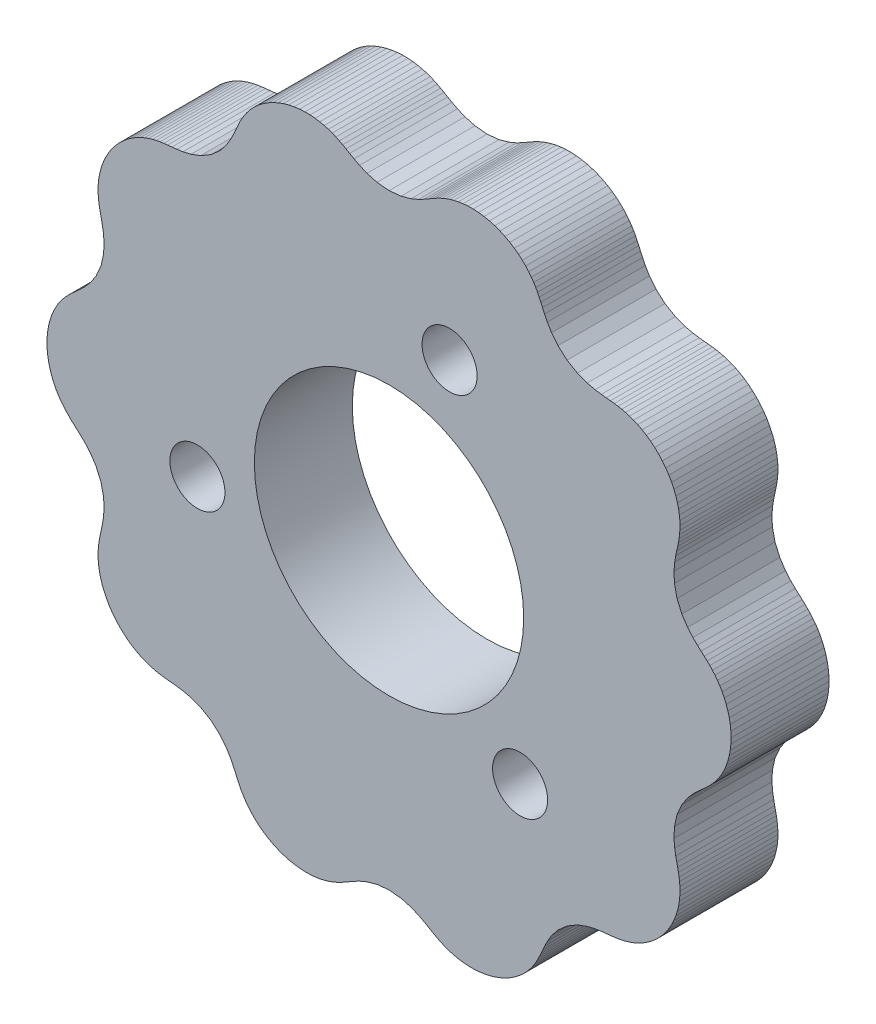
from build123d import *

# Parameters (mm, degrees)
MODEL_R             = 8.73125
BOSS_EXTRUDE1_DEPTH = 6.35
SKETCH2_R           = 1.78435
CUT_EXTRUDE1_DEPTH  = 33.323771723
SKETCH3_R           = 3.175
CUT_EXTRUDE2_DEPTH  = 3.81


with BuildPart() as part:
    # Model → Boss-Extrude1 (new body)
    with BuildSketch(Plane.XY):
        Polygon((20.90416592, 0), (20.890931284, 0.361246536), (20.851630676, 0.717938171), (20.787453815, 1.065699726), (20.70031633, 1.40051076), (20.592758773, 1.718871579), (20.467804656, 2.017956811), (20.328775926, 2.29575465), (20.179062376, 2.551192441), (20.021838, 2.784253604), (19.859711664, 2.996098554), (19.694291065, 3.189216289), (19.525628153, 3.36766), (19.351506826, 3.537471764), (19.166554614, 3.707500416), (18.961299064, 3.890989773), (18.721830857, 4.10851653), (18.432408361, 4.392542238), (18.086923383, 4.790426506), (17.715401805, 5.350520314), (17.403006197, 6.067227501), (17.234469638, 6.830677327), (17.205822028, 7.50217764), (17.251454741, 8.02714375), (17.318656337, 8.42704365), (17.384531166, 8.743782373), (17.442734057, 9.012874567), (17.492423206, 9.259142818), (17.533477467, 9.498869369), (17.565042048, 9.742370936), (17.585358367, 9.995838254), (17.59200199, 10.262519888), (17.582209268, 10.543484499), (17.553187508, 10.83813743), (17.502378641, 11.14459964), (17.427670756, 11.460010862), (17.327558853, 11.780790921), (17.201257572, 12.102876866), (17.048768629, 12.421944087), (16.870905406, 12.733613999), (16.669277065, 13.033647709), (16.446234634, 13.318123173), (16.204781691, 13.583592449), (15.948452407, 13.827215245), (15.681159712, 14.046864933), (15.407016027, 14.2412035), (15.130128134, 14.409722348), (14.854366055, 14.552746484), (14.583102683, 14.671400581), (14.318915576, 14.767536853), (14.063233278, 14.843627549), (13.815893445, 14.902631289), (13.574555701, 14.947857711), (13.333875739, 14.982892367), (13.084305922, 15.011736253), (12.810398356, 15.039536075), (12.488805487, 15.074763039), (12.087711646, 15.134426388), (11.574337923, 15.253250548), (10.944555773, 15.488001053), (10.270552502, 15.884207816), (9.685459013, 16.402788395), (9.267584629, 16.929204918), (8.995934932, 17.380733658), (8.815246902, 17.74375958), (8.682366407, 18.038726843), (8.571285112, 18.290637801), (8.466731632, 18.519079551), (8.359037495, 18.737153494), (8.241447148, 18.952703595), (8.108899044, 19.169704596), (7.957522317, 19.389359593), (7.784452983, 19.610908721), (7.587781239, 19.832229386), (7.366542034, 20.05029782), (7.120708021, 20.261558666), (6.851166002, 20.462230885), (6.559668751, 20.648565858), (6.248759598, 20.81706591), (5.92167025, 20.964666786), (5.582194105, 21.088884991), (5.234538506, 21.187929424), (4.883160046, 21.260776101), (4.532587413, 21.30720451), (4.187236233, 21.327794136), (3.851219989, 21.323879725), (3.528160084, 21.297463717), (3.220996399, 21.25108379), (2.931796592, 21.187632361), (2.66155725, 21.110122954), (2.409980937, 21.021395336), (2.17519728, 20.923747659), (1.95336752, 20.818481836), (1.738060486, 20.705357335), (1.519200252, 20.581999072), (1.281264051, 20.443490772), (1.000384065, 20.282962439), (0.640823095, 20.095474058), (0.155651939, 19.889851319), (-0.491835408, 19.709591807), (-1.27, 19.63396063), (-2.048164592, 19.709591807), (-2.695651939, 19.889851319), (-3.180823095, 20.095474058), (-3.540384065, 20.282962439), (-3.821264051, 20.443490772), (-4.059200252, 20.581999072), (-4.278060486, 20.705357335), (-4.49336752, 20.818481836), (-4.71519728, 20.923747659), (-4.949980937, 21.021395336), (-5.20155725, 21.110122954), (-5.471796592, 21.187632361), (-5.760996399, 21.25108379), (-6.068160084, 21.297463717), (-6.391219989, 21.323879725), (-6.727236233, 21.327794136), (-7.072587413, 21.30720451), (-7.423160046, 21.260776101), (-7.774538506, 21.187929424), (-8.122194105, 21.088884991), (-8.46167025, 20.964666786), (-8.788759598, 20.81706591), (-9.099668751, 20.648565858), (-9.391166002, 20.462230885), (-9.660708021, 20.261558666), (-9.906542034, 20.05029782), (-10.127781239, 19.832229386), (-10.324452983, 19.610908721), (-10.497522317, 19.389359593), (-10.648899044, 19.169704596), (-10.781447148, 18.952703595), (-10.899037495, 18.737153494), (-11.006731632, 18.519079551), (-11.111285112, 18.290637801), (-11.222366407, 18.038726843), (-11.355246902, 17.74375958), (-11.535934932, 17.380733658), (-11.807584629, 16.929204918), (-12.225459013, 16.402788395), (-12.810552502, 15.884207816), (-13.484555773, 15.488001053), (-14.114337923, 15.253250548), (-14.627711646, 15.134426388), (-15.028805487, 15.074763039), (-15.350398356, 15.039536075), (-15.624305922, 15.011736253), (-15.873875739, 14.982892367), (-16.114555701, 14.947857711), (-16.355893445, 14.902631289), (-16.603233278, 14.843627549), (-16.858915576, 14.767536853), (-17.123102683, 14.671400581), (-17.394366055, 14.552746484), (-17.670128134, 14.409722348), (-17.947016027, 14.2412035), (-18.221159712, 14.046864933), (-18.488452407, 13.827215245), (-18.744781691, 13.583592449), (-18.986234634, 13.318123173), (-19.209277065, 13.033647709), (-19.410905406, 12.733613999), (-19.588768629, 12.421944087), (-19.741257572, 12.102876866), (-19.867558853, 11.780790921), (-19.967670756, 11.460010862), (-20.042378641, 11.14459964), (-20.093187508, 10.83813743), (-20.122209268, 10.543484499), (-20.13200199, 10.262519888), (-20.125358367, 9.995838254), (-20.105042048, 9.742370936), (-20.073477467, 9.498869369), (-20.032423206, 9.259142818), (-19.982734057, 9.012874567), (-19.924531166, 8.743782373), (-19.858656337, 8.42704365), (-19.791454741, 8.02714375), (-19.745822028, 7.50217764), (-19.774469638, 6.830677327), (-19.943006197, 6.067227501), (-20.255401805, 5.350520314), (-20.626923383, 4.790426506), (-20.972408361, 4.392542238), (-21.261830857, 4.10851653), (-21.501299064, 3.890989773), (-21.706554614, 3.707500416), (-21.891506826, 3.537471764), (-22.065628153, 3.36766), (-22.234291065, 3.189216289), (-22.399711664, 2.996098554), (-22.561838, 2.784253604), (-22.719062376, 2.551192441), (-22.868775926, 2.29575465), (-23.007804656, 2.017956811), (-23.132758773, 1.718871579), (-23.24031633, 1.40051076), (-23.327453815, 1.065699726), (-23.391630676, 0.717938171), (-23.430931284, 0.361246536), (-23.44416592, 0), (-23.430931284, -0.361246536), (-23.391630676, -0.717938171), (-23.327453815, -1.065699726), (-23.24031633, -1.40051076), (-23.132758773, -1.718871579), (-23.007804656, -2.017956811), (-22.868775926, -2.29575465), (-22.719062376, -2.551192441), (-22.561838, -2.784253604), (-22.399711664, -2.996098554), (-22.234291065, -3.189216289), (-22.065628153, -3.36766), (-21.891506826, -3.537471764), (-21.706554614, -3.707500416), (-21.501299064, -3.890989773), (-21.261830857, -4.10851653), (-20.972408361, -4.392542238), (-20.626923383, -4.790426506), (-20.255401805, -5.350520314), (-19.943006197, -6.067227501), (-19.774469638, -6.830677327), (-19.745822028, -7.50217764), (-19.791454741, -8.02714375), (-19.858656337, -8.42704365), (-19.924531166, -8.743782373), (-19.982734057, -9.012874567), (-20.032423206, -9.259142818), (-20.073477467, -9.498869369), (-20.105042048, -9.742370936), (-20.125358367, -9.995838254), (-20.13200199, -10.262519888), (-20.122209268, -10.543484499), (-20.093187508, -10.83813743), (-20.042378641, -11.14459964), (-19.967670756, -11.460010862), (-19.867558853, -11.780790921), (-19.741257572, -12.102876866), (-19.588768629, -12.421944087), (-19.410905406, -12.733613999), (-19.209277065, -13.033647709), (-18.986234634, -13.318123173), (-18.744781691, -13.583592449), (-18.488452407, -13.827215245), (-18.221159712, -14.046864933), (-17.947016027, -14.2412035), (-17.670128134, -14.409722348), (-17.394366055, -14.552746484), (-17.123102683, -14.671400581), (-16.858915576, -14.767536853), (-16.603233278, -14.843627549), (-16.355893445, -14.902631289), (-16.114555701, -14.947857711), (-15.873875739, -14.982892367), (-15.624305922, -15.011736253), (-15.350398356, -15.039536075), (-15.028805487, -15.074763039), (-14.627711646, -15.134426388), (-14.114337923, -15.253250548), (-13.484555773, -15.488001053), (-12.810552502, -15.884207816), (-12.225459013, -16.402788395), (-11.807584629, -16.929204918), (-11.535934932, -17.380733658), (-11.355246902, -17.74375958), (-11.222366407, -18.038726843), (-11.111285112, -18.290637801), (-11.006731632, -18.519079551), (-10.899037495, -18.737153494), (-10.781447148, -18.952703595), (-10.648899044, -19.169704596), (-10.497522317, -19.389359593), (-10.324452983, -19.610908721), (-10.127781239, -19.832229386), (-9.906542034, -20.05029782), (-9.660708021, -20.261558666), (-9.391166002, -20.462230885), (-9.099668751, -20.648565858), (-8.788759598, -20.81706591), (-8.46167025, -20.964666786), (-8.122194105, -21.088884991), (-7.774538506, -21.187929424), (-7.423160046, -21.260776101), (-7.072587413, -21.30720451), (-6.727236233, -21.327794136), (-6.391219989, -21.323879725), (-6.068160084, -21.297463717), (-5.760996399, -21.25108379), (-5.471796592, -21.187632361), (-5.20155725, -21.110122954), (-4.949980937, -21.021395336), (-4.71519728, -20.923747659), (-4.49336752, -20.818481836), (-4.278060486, -20.705357335), (-4.059200252, -20.581999072), (-3.821264051, -20.443490772), (-3.540384065, -20.282962439), (-3.180823095, -20.095474058), (-2.695651939, -19.889851319), (-2.048164592, -19.709591807), (-1.27, -19.63396063), (-0.491835408, -19.709591807), (0.155651939, -19.889851319), (0.640823095, -20.095474058), (1.000384065, -20.282962439), (1.281264051, -20.443490772), (1.519200252, -20.581999072), (1.738060486, -20.705357335), (1.95336752, -20.818481836), (2.17519728, -20.923747659), (2.409980937, -21.021395336), (2.66155725, -21.110122954), (2.931796592, -21.187632361), (3.220996399, -21.25108379), (3.528160084, -21.297463717), (3.851219989, -21.323879725), (4.187236233, -21.327794136), (4.532587413, -21.30720451), (4.883160046, -21.260776101), (5.234538506, -21.187929424), (5.582194105, -21.088884991), (5.92167025, -20.964666786), (6.248759598, -20.81706591), (6.559668751, -20.648565858), (6.851166002, -20.462230885), (7.120708021, -20.261558666), (7.366542034, -20.05029782), (7.587781239, -19.832229386), (7.784452983, -19.610908721), (7.957522317, -19.389359593), (8.108899044, -19.169704596), (8.241447148, -18.952703595), (8.359037495, -18.737153494), (8.466731632, -18.519079551), (8.571285112, -18.290637801), (8.682366407, -18.038726843), (8.815246902, -17.74375958), (8.995934932, -17.380733658), (9.267584629, -16.929204918), (9.685459013, -16.402788395), (10.270552502, -15.884207816), (10.944555773, -15.488001053), (11.574337923, -15.253250548), (12.087711646, -15.134426388), (12.488805487, -15.074763039), (12.810398356, -15.039536075), (13.084305922, -15.011736253), (13.333875739, -14.982892367), (13.574555701, -14.947857711), (13.815893445, -14.902631289), (14.063233278, -14.843627549), (14.318915576, -14.767536853), (14.583102683, -14.671400581), (14.854366055, -14.552746484), (15.130128134, -14.409722348), (15.407016027, -14.2412035), (15.681159712, -14.046864933), (15.948452407, -13.827215245), (16.204781691, -13.583592449), (16.446234634, -13.318123173), (16.669277065, -13.033647709), (16.870905406, -12.733613999), (17.048768629, -12.421944087), (17.201257572, -12.102876866), (17.327558853, -11.780790921), (17.427670756, -11.460010862), (17.502378641, -11.14459964), (17.553187508, -10.83813743), (17.582209268, -10.543484499), (17.59200199, -10.262519888), (17.585358367, -9.995838254), (17.565042048, -9.742370936), (17.533477467, -9.498869369), (17.492423206, -9.259142818), (17.442734057, -9.012874567), (17.384531166, -8.743782373), (17.318656337, -8.42704365), (17.251454741, -8.02714375), (17.205822028, -7.50217764), (17.234469638, -6.830677327), (17.403006197, -6.067227501), (17.715401805, -5.350520314), (18.086923383, -4.790426506), (18.432408361, -4.392542238), (18.721830857, -4.10851653), (18.961299064, -3.890989773), (19.166554614, -3.707500416), (19.351506826, -3.537471764), (19.525628153, -3.36766), (19.694291065, -3.189216289), (19.859711664, -2.996098554), (20.021838, -2.784253604), (20.179062376, -2.551192441), (20.328775926, -2.29575465), (20.467804656, -2.017956811), (20.592758773, -1.718871579), (20.70031633, -1.40051076), (20.787453815, -1.065699726), (20.851630676, -0.717938171), (20.890931284, -0.361246536), align=None)
        with Locations((-1.27, 0)):
            Circle(MODEL_R, mode=Mode.SUBTRACT)
    extrude(amount=BOSS_EXTRUDE1_DEPTH)

    # Sketch2 → Cut-Extrude1 (cut, through all)
    with BuildSketch(Plane.XY.offset(6.35)):
        with Locations((2.654515829, 12.078417757)):
            Circle(SKETCH2_R)
        with Locations((7.227958701, -9.437939284)):
            Circle(SKETCH2_R)
        with Locations((-13.692474529, -2.640478473)):
            Circle(SKETCH2_R)
    extrude(amount=-CUT_EXTRUDE1_DEPTH, mode=Mode.SUBTRACT)

    # Sketch3 → Cut-Extrude2 (cut)
    with BuildSketch(Plane(origin=(0, 0, 0), x_dir=(-1, 0, 0), z_dir=(0, 0, -1))):
        with Locations((-2.654515829, 12.078417757)):
            Circle(SKETCH3_R)
        with Locations((13.692474529, -2.640478473)):
            Circle(SKETCH3_R)
        with Locations((-7.227958701, -9.437939284)):
            Circle(SKETCH3_R)
    extrude(amount=-CUT_EXTRUDE2_DEPTH, mode=Mode.SUBTRACT)


solid = part.part
